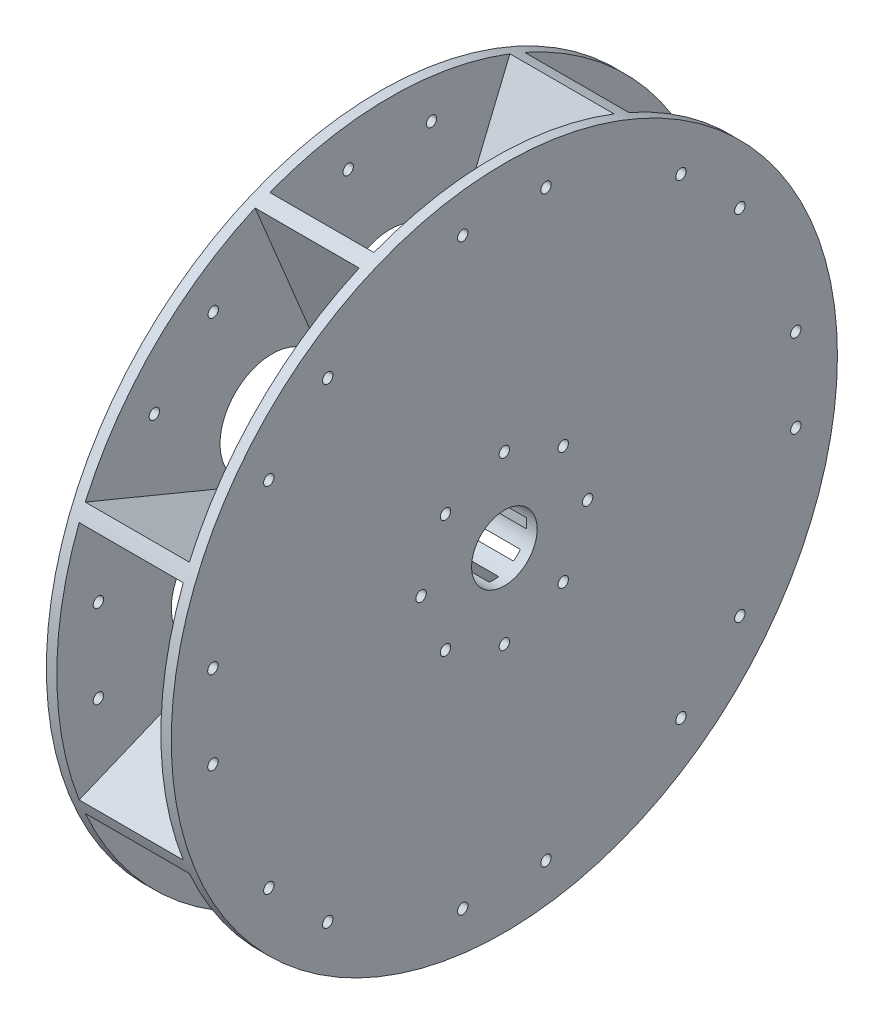
from build123d import *

# Parameters (mm, degrees)
SKETCH1_R           = 203.2
BOSS_EXTRUDE1_DEPTH = 76.2
SKETCH6_R           = 31.75
SKETCH6_R_2         = 3.175
CUT_EXTRUDE1_DEPTH  = 298.299377732
CIRPATTERN1_COUNT   = 8
CUT_EXTRUDE3_DEPTH  = 31.75
CIRPATTERN2_COUNT   = 8
SKETCH11_R          = 31.75
BOSS_EXTRUDE2_DEPTH = 6.35
CIRPATTERN4_COUNT   = 8
CUT_EXTRUDE4_REACH  = 299.299
SKETCH12_R          = 20


with BuildPart() as part:
    # Sketch1 → Boss-Extrude1 (new body)
    with BuildSketch(Plane(origin=(0, 0, 0), x_dir=(0, 0, -1), z_dir=(1, 0, 0))):
        with Locations(Location((0, 0, 0), (0, 0, 180))):
            Circle(SKETCH1_R)
    extrude(amount=BOSS_EXTRUDE1_DEPTH)

    # Sketch6 → Cut-Extrude1 (cut, through all)
    with BuildSketch(Plane(origin=(76.2, 0, 0), x_dir=(0, 0, -1), z_dir=(1, 0, 0))):
        with Locations((0, 101.6)):
            Circle(SKETCH6_R)
        with Locations((25.4, 177.8)):
            Circle(SKETCH6_R_2)
        with Locations((-25.4, 177.8)):
            Circle(SKETCH6_R_2)
        with Locations((0, 50.8)):
            Circle(SKETCH6_R_2)
    cut_extrude1 = extrude(amount=-CUT_EXTRUDE1_DEPTH, mode=Mode.SUBTRACT)

    # CirPattern1: Cut-Extrude1 ×8 about axis
    cirpattern1_axis = Axis((0, 0, 0), (1, 0, 0))
    for i in range(1, CIRPATTERN1_COUNT):
        add(cut_extrude1.rotate(cirpattern1_axis, i * 360 / CIRPATTERN1_COUNT), mode=Mode.SUBTRACT)

    # Sketch8 → Cut-Extrude3 (cut, symmetric)
    with BuildSketch(Plane(origin=(38.1, 0, 0), x_dir=(0, 0, -1), z_dir=(1, 0, 0))):
        with BuildLine():
            Line((12.7, 0), (189.538488464, -73.248900271))
            ThreePointArc((189.538488464, -73.248900271), (203.2, 0), (189.538488464, 73.248900271))
            Line((189.538488464, 73.248900271), (12.7, 0))
        make_face()
    cut_extrude3 = extrude(amount=CUT_EXTRUDE3_DEPTH, both=True, mode=Mode.SUBTRACT)

    # CirPattern2: Cut-Extrude3 ×8 about axis
    cirpattern2_axis = Axis((0, 0, 0), (1, 0, 0))
    for i in range(1, CIRPATTERN2_COUNT):
        add(cut_extrude3.rotate(cirpattern2_axis, i * 360 / CIRPATTERN2_COUNT), mode=Mode.SUBTRACT)

    # Sketch11 → Boss-Extrude2 (add)
    with BuildSketch(Plane(origin=(76.2, 0, 0), x_dir=(0, 0, -1), z_dir=(1, 0, 0))):
        with Locations((0, 101.6)):
            Circle(SKETCH11_R)
    boss_extrude2 = extrude(amount=-BOSS_EXTRUDE2_DEPTH)

    # CirPattern4: Boss-Extrude2 ×8 about axis
    cirpattern4_axis = Axis((0, 0, 0), (-1, 0, 0))
    for i in range(1, CIRPATTERN4_COUNT):
        add(boss_extrude2.rotate(cirpattern4_axis, i * 360 / CIRPATTERN4_COUNT))

    # Cut-Extrude4: up to this face of the body (flat: up to its plane)
    cut_extrude4_end = Plane(part.part.faces().sort_by_distance((76.2, 0, 0))[0])
    # Sketch12 → Cut-Extrude4 (cut, up to the picked face)
    with BuildSketch(Plane.ZY, mode=Mode.PRIVATE) as cut_extrude4_sk1:
        Circle(SKETCH12_R)
    cut_extrude4_tool1 = split(extrude(cut_extrude4_sk1.sketch, amount=-CUT_EXTRUDE4_REACH, mode=Mode.PRIVATE), bisect_by=cut_extrude4_end, keep=Keep.BOTH, mode=Mode.PRIVATE)
    add(cut_extrude4_tool1.solids().sort_by(Axis((0, 0, 0), (1, 0, 0)))[0], mode=Mode.SUBTRACT)


solid = part.part
